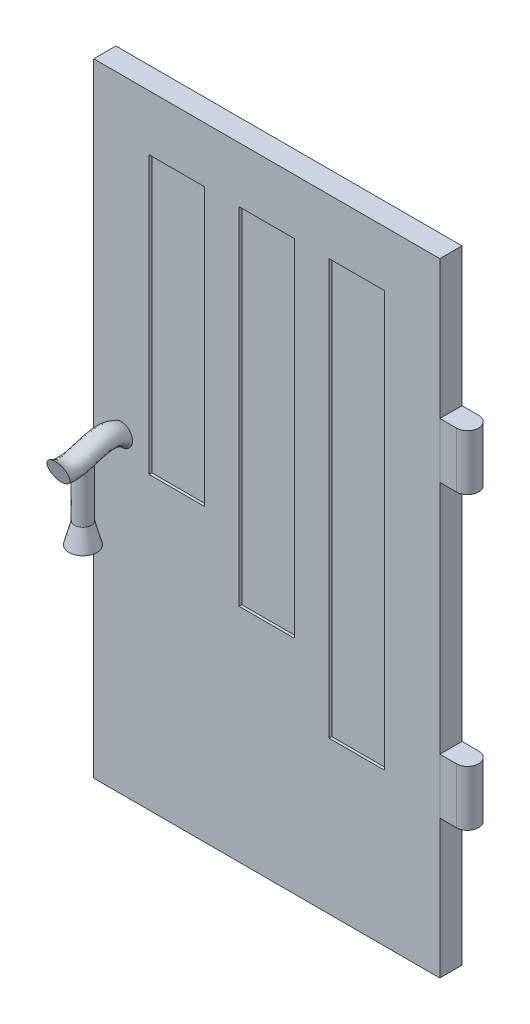
from build123d import *

# Parameters (mm, degrees)
SALIENTE_EXTRUIR1_DEPTH   = 8
CROQUIS17_W               = 10
CROQUIS17_H               = 20
SALIENTE_EXTRUIR3_DEPTH   = 8
SALIENTE_EXTRUIR3_2_DEPTH = 8
REDONDEO1_RADIUS          = 4
REDONDEO1_LENGTH          = 20
REDONDEO2_RADIUS          = 4
REDONDEO2_LENGTH          = 20
CROQUIS18_R               = 2
CORTAR_EXTRUIR2_DEPTH     = 10
CROQUIS19_R               = 2
CORTAR_EXTRUIR3_DEPTH     = 10
CROQUIS20_W               = 20
CROQUIS20_H               = 100
CROQUIS20_H_2             = 125
CROQUIS20_H_3             = 150
CORTAR_EXTRUIR4_DEPTH     = 1
CROQUIS22_R               = 4
CROQUIS25_R               = 3
SALIENTE_EXTRUIR4_DEPTH   = 20


with BuildPart() as part:
    # Croquis15 → Saliente-Extruir1 (new body)
    with BuildSketch(Plane.XY):
        Polygon((-62.5, -112.5), (62.5, -112.5), (62.5, -62.5), (62.5, -42.5), (62.5, 112.5), (-62.5, 112.5), align=None)
    extrude(amount=SALIENTE_EXTRUIR1_DEPTH)

    # Croquis20 → Cortar-Extruir4 (cut)
    with BuildSketch(Plane.XY.offset(8)):
        with Locations((-32.5, 42.5)):
            Rectangle(CROQUIS20_W, CROQUIS20_H)
        with Locations((0, 30)):
            Rectangle(CROQUIS20_W, CROQUIS20_H_2)
        with Locations((32.5, 17.5)):
            Rectangle(CROQUIS20_W, CROQUIS20_H_3)
    extrude(amount=-CORTAR_EXTRUIR4_DEPTH, mode=Mode.SUBTRACT)

    # Barrer1: sweep along a path in Croquis23
    with BuildLine() as barrer1_path:  # in the path sketch's own coordinates; laid on its plane below (add() does not lay a ready-made edge on the line's plane)
        add(Edge.make_bspline(
            [(8, 0), (16.008022833, 5.494506699), (22.815687146, -2.863995284), (30.763531117, -0.316827761)],
            knots=[0, 0, 0, 0, 1, 1, 1, 1], degree=3))
    # Croquis22 → Barrer1 (sweep)
    with BuildSketch(Plane.XY.offset(8)):
        with Locations((-52.5, 0)):
            Circle(CROQUIS22_R)
    sweep(path=Plane.ZY.offset(52.5) * barrer1_path.line)

    # Croquis25 → Saliente-Extruir4 (add)
    with BuildSketch(Plane(origin=(0, 0, 0), x_dir=(1, 0, 0), z_dir=(0, 1, 0))):
        with Locations(Location((-52.5, -21.876851305, 0), (0, 0, 270))):
            Circle(CROQUIS25_R)
    extrude(amount=-SALIENTE_EXTRUIR4_DEPTH)

    # Croquis26 → Revolución2 (revolve)
    with BuildSketch(Plane.ZY.offset(52.5)):
        Polygon((21.876851305, -20), (21.876851305, -27.5), (26.876851305, -27.5), (24.876851305, -20), align=None)
    revolve(axis=Axis((-52.5, -20, 21.876851305), (0, -1, 0)))


with BuildPart() as body_2:
    # Croquis17 → Saliente-Extruir3 (new body)
    with BuildSketch(Plane.XY):
        with Locations((67.5, 52.5)):
            Rectangle(CROQUIS17_W, CROQUIS17_H)
    extrude(amount=SALIENTE_EXTRUIR3_DEPTH)

    # Redondeo1: full round fillet: the end face becomes a half cylinder, R = half its width
    redondeo1_face = Plane((72.5, 52.5, 4), x_dir=(0, -1, 0), z_dir=(1, 0, 0))  # on the end face: x along it, z out of the body
    redondeo1_slab = redondeo1_face.offset(-REDONDEO1_RADIUS / 2) * Box(REDONDEO1_LENGTH, 2 * REDONDEO1_RADIUS, REDONDEO1_RADIUS, mode=Mode.PRIVATE)  # the body's end, R deep
    redondeo1_round = Plane((68.5, 52.5, 4), x_dir=(1, 0, 0), z_dir=(0, -1, 0)) * Cylinder(REDONDEO1_RADIUS, REDONDEO1_LENGTH, mode=Mode.PRIVATE)  # its axis R under the face
    add(redondeo1_slab - redondeo1_round, mode=Mode.SUBTRACT)

    # Croquis19 → Cortar-Extruir3 (cut)
    with BuildSketch(Plane.XZ.offset(-42.5)):
        with Locations((68.5, 4)):
            Circle(CROQUIS19_R)
    extrude(amount=-CORTAR_EXTRUIR3_DEPTH, mode=Mode.SUBTRACT)


with BuildPart() as body_3:
    # Croquis17 → Saliente-Extruir3 2 (new body)
    with BuildSketch(Plane.XY):
        with Locations((67.5, -52.5)):
            Rectangle(CROQUIS17_W, CROQUIS17_H)
    extrude(amount=SALIENTE_EXTRUIR3_2_DEPTH)

    # Redondeo2: full round fillet: the end face becomes a half cylinder, R = half its width
    redondeo2_face = Plane((72.5, -52.5, 4), x_dir=(0, -1, 0), z_dir=(1, 0, 0))  # on the end face: x along it, z out of the body
    redondeo2_slab = redondeo2_face.offset(-REDONDEO2_RADIUS / 2) * Box(REDONDEO2_LENGTH, 2 * REDONDEO2_RADIUS, REDONDEO2_RADIUS, mode=Mode.PRIVATE)  # the body's end, R deep
    redondeo2_round = Plane((68.5, -52.5, 4), x_dir=(1, 0, 0), z_dir=(0, -1, 0)) * Cylinder(REDONDEO2_RADIUS, REDONDEO2_LENGTH, mode=Mode.PRIVATE)  # its axis R under the face
    add(redondeo2_slab - redondeo2_round, mode=Mode.SUBTRACT)

    # Croquis18 → Cortar-Extruir2 (cut)
    with BuildSketch(Plane.XZ.offset(62.5)):
        with Locations((68.5, 4)):
            Circle(CROQUIS18_R)
    extrude(amount=-CORTAR_EXTRUIR2_DEPTH, mode=Mode.SUBTRACT)


solid = Compound([part.part, body_2.part, body_3.part])
